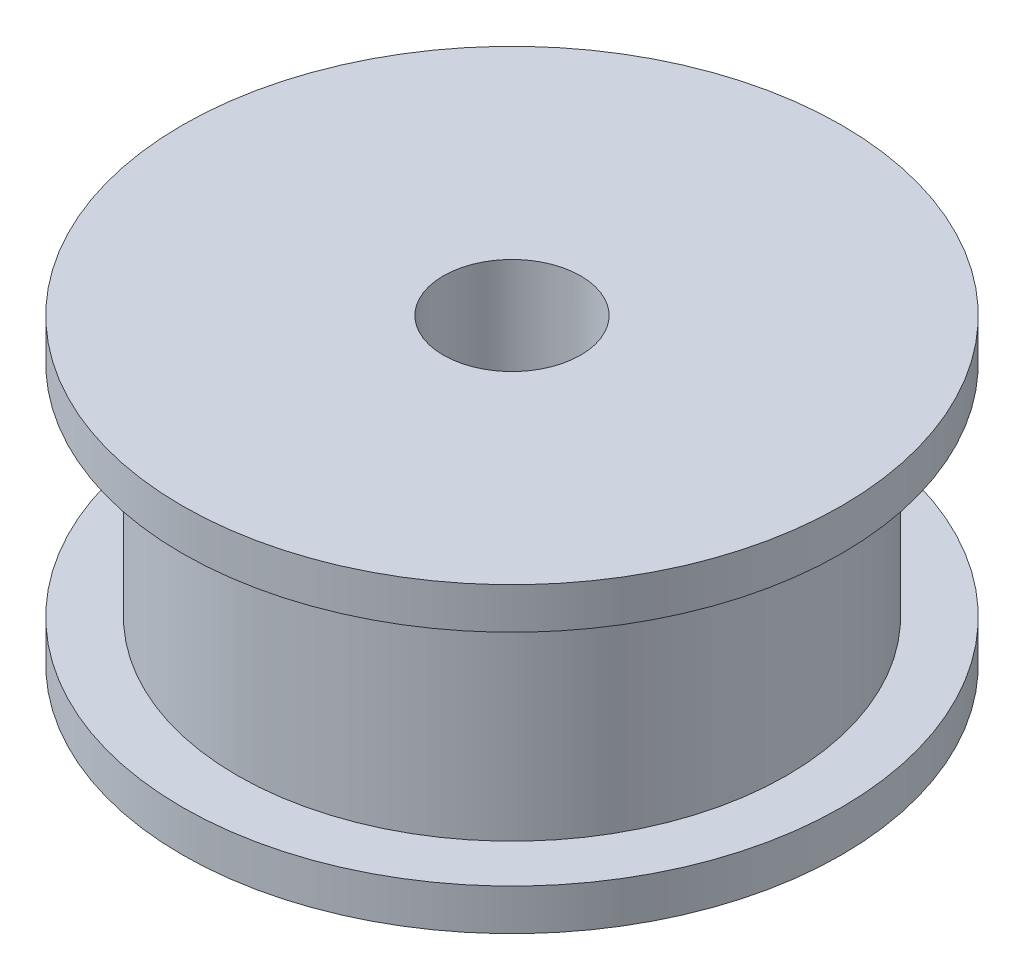
from build123d import *
from build123d.topology import SkipClean

# Parameters (mm, degrees)
SKETCH_1_R      = 20
SKETCH_1_R_2    = 5
EXTRUDE_1_DEPTH = 16
EXTRUDE_START   = 3
SKETCH_2_R      = 24
SKETCH_2_R_2    = 5
EXTRUDE_2_DEPTH = 3
EXTRUDE_START_2 = -16
SKETCH_2_2_R    = 24
SKETCH_2_2_R_2  = 5
EXTRUDE_3_DEPTH = 3


with BuildPart() as part:
    # 草图1 → 凸台-拉伸1 (new body)
    with BuildSketch(Plane(origin=(0, 0, 0), x_dir=(1, 0, 0), z_dir=(0, 1, 0))):
        with Locations(Location((0, 0, 0), (0, 0, 270))):
            Circle(SKETCH_1_R)
        with Locations(Location((0, 0, 0), (0, 0, 270))):
            Circle(SKETCH_1_R_2, mode=Mode.SUBTRACT)
    extrude(amount=EXTRUDE_1_DEPTH)

    # 草图2 → 凸台-拉伸2 (add)
    with SkipClean():  # the faces are left unmerged after this step: merging them gives an invalid solid
        with BuildSketch(Plane.XZ.offset(EXTRUDE_START)):
            with Locations(Location((0, 0, 0), (0, 0, 270))):
                Circle(SKETCH_2_R)
            with Locations(Location((0, 0, 0), (0, 0, 270))):
                Circle(SKETCH_2_R_2, mode=Mode.SUBTRACT)
        extrude(amount=-EXTRUDE_2_DEPTH)

    # 草图2<2> → 凸台-拉伸3 (add)
    with BuildSketch(Plane.XZ.offset(EXTRUDE_START_2)):
        with Locations(Location((0, 0, 0), (0, 0, 270))):
            Circle(SKETCH_2_2_R)
        with Locations(Location((0, 0, 0), (0, 0, 270))):
            Circle(SKETCH_2_2_R_2, mode=Mode.SUBTRACT)
    extrude(amount=-EXTRUDE_3_DEPTH)


solid = part.part
